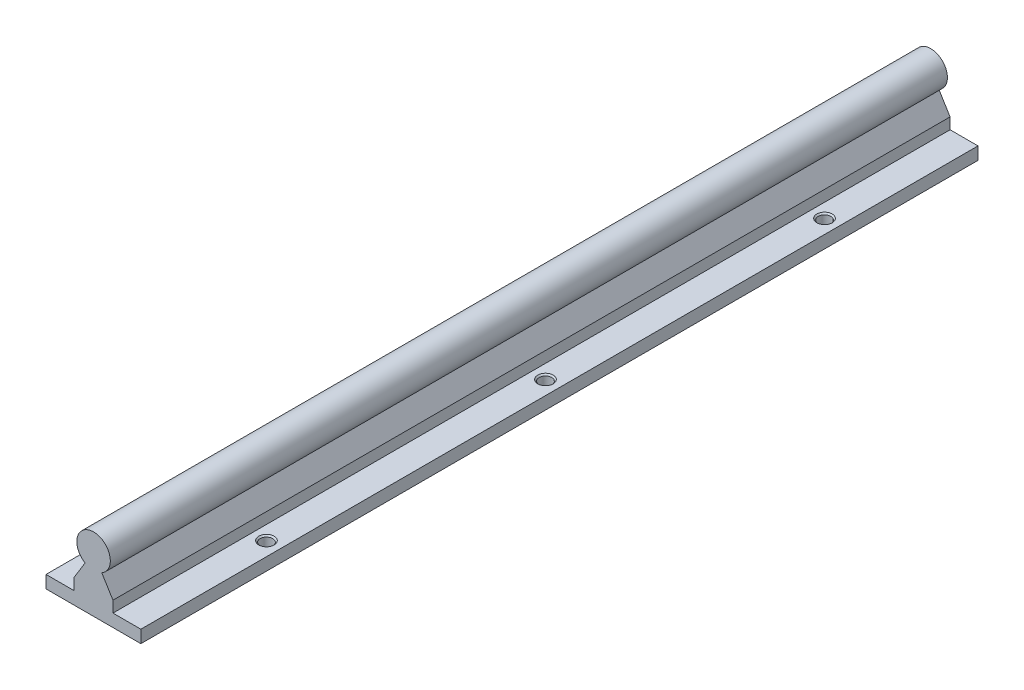
from build123d import *

# Parameters (mm, degrees)
EXTRUSION1_DEPTH                               = 300
FRAISAGE_POUR_VIS_T_TE_FRAIS_E_M41_D           = 4.5
FRAISAGE_POUR_VIS_T_TE_FRAIS_E_M41_CSINK_D     = 5.5
FRAISAGE_POUR_VIS_T_TE_FRAIS_E_M41_CSINK_ANGLE = 90


with BuildPart() as part:
    # Esquisse1 → Extrusion1 (new body)
    with BuildSketch(Plane.XY):
        with BuildLine():
            Line((-38.885451278, -19.821642953), (-4.885451278, -19.821642953))
            Line((-4.885451278, -19.821642953), (-4.885451278, -15.321642953))
            Line((-4.885451278, -15.321642953), (-14.885451278, -15.321642953))
            Line((-14.885451278, -15.321642953), (-14.885451278, -11.321642953))
            Line((-14.885451278, -11.321642953), (-18.885451278, -4.821642953))
            ThreePointArc((-18.885451278, -4.821642953), (-21.78726352, 6.400322803), (-24.885451278, -4.769021956))
            Line((-24.885451278, -4.769021956), (-28.885451278, -11.321642953))
            Line((-28.885451278, -11.321642953), (-28.885451278, -15.321642953))
            Line((-28.885451278, -15.321642953), (-38.885451278, -15.321642953))
            Line((-38.885451278, -15.321642953), (-38.885451278, -19.821642953))
        make_face()
    extrude(amount=EXTRUSION1_DEPTH)

    # Fraisage pour vis à tête fraisée M41 (through all)
    with Locations(Plane(origin=(-33.885451278, -15.321642953, 50), x_dir=(1, 0, 0), z_dir=(0, 1, 0))):
        with Locations((0, 0), (0, -100), (0, -200), (24, -200), (24, -100), (24, 0)):
            CounterSinkHole(FRAISAGE_POUR_VIS_T_TE_FRAIS_E_M41_D / 2, FRAISAGE_POUR_VIS_T_TE_FRAIS_E_M41_CSINK_D / 2, counter_sink_angle=FRAISAGE_POUR_VIS_T_TE_FRAIS_E_M41_CSINK_ANGLE)


solid = part.part
